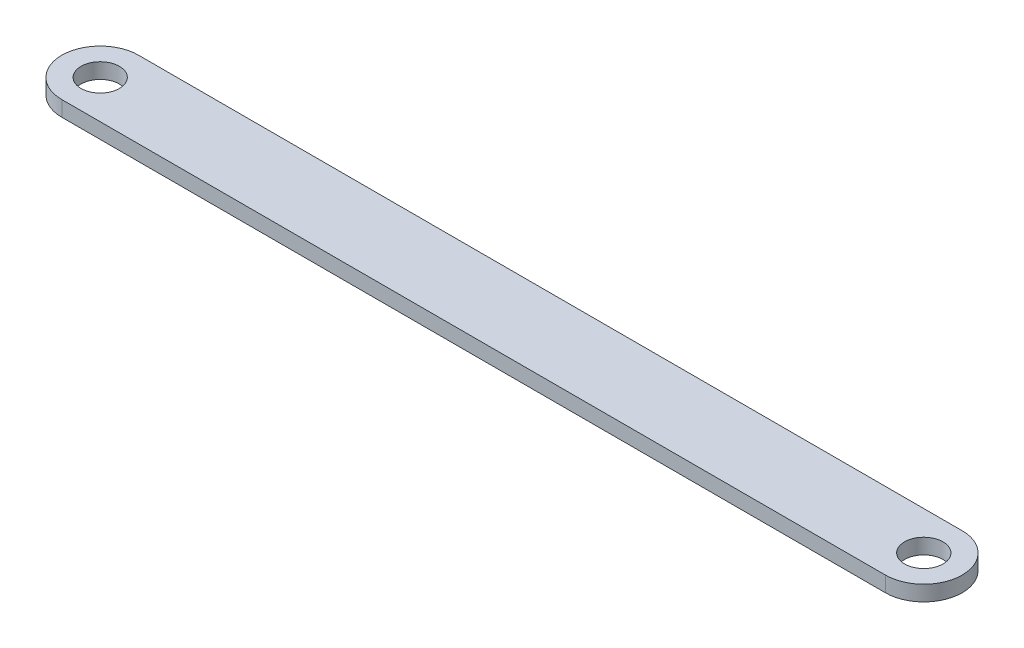
from build123d import *

# Parameters (mm, degrees)
SKETCH2_R           = 6.35
BOSS_EXTRUDE1_DEPTH = 5.08


with BuildPart() as part:
    # Sketch2 → Boss-Extrude1 (new body)
    with BuildSketch(Plane(origin=(0, 0, 0), x_dir=(1, 0, 0), z_dir=(0, 1, 0))):
        with BuildLine():
            Line((-272.4, -12.7), (0, -12.7))
            ThreePointArc((0, -12.7), (12.7, 0), (0, 12.7))
            Line((0, 12.7), (-272.4, 12.7))
            ThreePointArc((-272.4, 12.7), (-285.1, 0), (-272.4, -12.7))
        make_face()
        with Locations(Location((0, 0, 0), (0, 0, 270))):
            Circle(SKETCH2_R, mode=Mode.SUBTRACT)
        with Locations(Location((-272.4, 0, 0), (0, 0, 270))):
            Circle(SKETCH2_R, mode=Mode.SUBTRACT)
    extrude(amount=BOSS_EXTRUDE1_DEPTH)


solid = part.part
